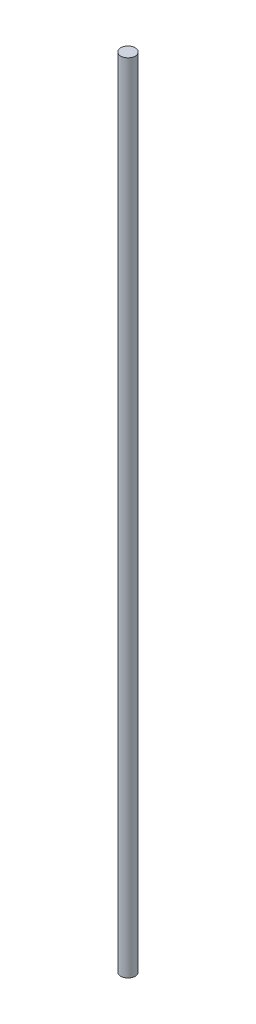
from build123d import *

# Parameters (mm, degrees)
SKETCH1_R           = 2.5
BOSS_EXTRUDE1_DEPTH = 275


with BuildPart() as part:
    # Sketch1 → Boss-Extrude1 (new body)
    with BuildSketch(Plane(origin=(0, 0, 0), x_dir=(1, 0, 0), z_dir=(0, 1, 0))):
        with Locations(Location((0, 0, 0), (0, 0, 270))):
            Circle(SKETCH1_R)
    extrude(amount=BOSS_EXTRUDE1_DEPTH)


solid = part.part
